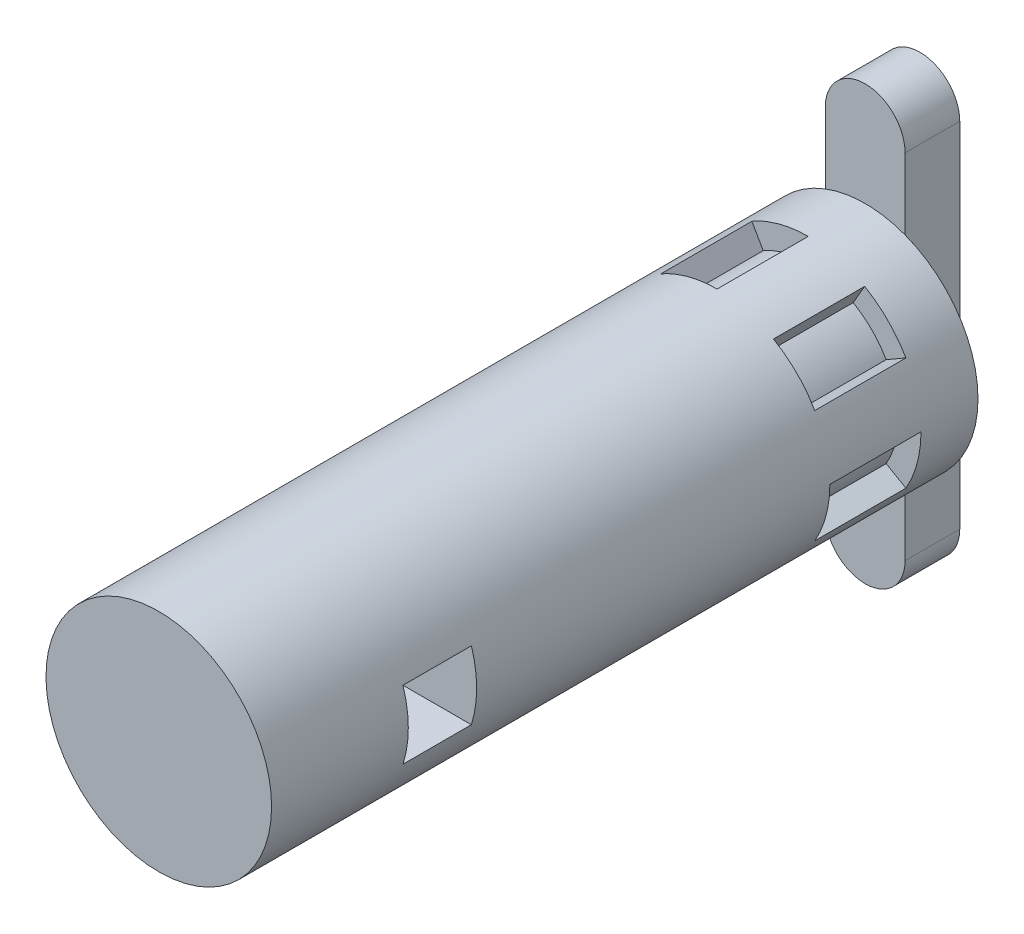
from build123d import *

# Parameters (mm, degrees)
SKETCH_1_R               = 4.95
EXTRUDE_1_DEPTH          = 4.5
CUT_EXTRUDE_1_DEPTH      = 2
PATTERN_CIRCULAR_1_COUNT = 6
MIRROR_1_COPY_1_DEPTH    = 2
MIRROR_1_COPY_2_DEPTH    = 2
MIRROR_1_COPY_3_DEPTH    = 2
MIRROR_1_COPY_4_DEPTH    = 2
MIRROR_1_COPY_5_DEPTH    = 2
EXTRUDE_2_DEPTH          = 2.4
SKETCH_5_R               = 4.95
EXTRUDE_3_DEPTH          = 22
CUT_EXTRUDE_2_DEPTH      = 29.583255588
CUT_EXTRUDE_2_DEPTH_BACK = 29.583255588
SKETCH_6_W               = 3
SKETCH_6_H               = 3


with BuildPart() as part:
    # 草图1 → 凸台-拉伸1 (new body)
    with BuildSketch(Plane.XY):
        Circle(SKETCH_1_R)
    extrude_1 = extrude(amount=EXTRUDE_1_DEPTH)

    # 草图2 → 切除-拉伸1 (cut)
    with BuildSketch(Plane(origin=(0, 0, 0), x_dir=(-1, 0, 0), z_dir=(0, 0, -1))):
        with BuildLine():
            Line((0, 4.95), (0, 3.95))
            ThreePointArc((0, 3.95), (1.022335228, 3.815407014), (1.975, 3.420800345))
            Line((1.975, 3.420800345), (2.475, 4.286825749))
            ThreePointArc((2.475, 4.286825749), (1.281154273, 4.78133284), (0, 4.95))
        make_face()
    cut_extrude_1 = extrude(amount=-CUT_EXTRUDE_1_DEPTH, mode=Mode.SUBTRACT)

    # 阵列(圆周)1: 切除-拉伸1 ×6 about axis
    pattern_circular_1_axis = Axis((0, 0, 0), (0, 0, 1))
    for i in range(1, PATTERN_CIRCULAR_1_COUNT):
        add(cut_extrude_1.rotate(pattern_circular_1_axis, i * 360 / PATTERN_CIRCULAR_1_COUNT), mode=Mode.SUBTRACT)

    # 镜向1: 凸台-拉伸1, 切除-拉伸1 across plane
    add(extrude_1.mirror(Plane.XY))
    add(cut_extrude_1.mirror(Plane.XY), mode=Mode.SUBTRACT)

    # 镜向1 copy 1 sketch → 镜向1 copy 1 (cut)
    with BuildSketch(Plane(origin=(0, 0, 0), x_dir=(-0.5000000000000001, -0.8660254037844386, 0), z_dir=(0, 0, 1))):
        with BuildLine():
            Line((0, -4.95), (0, -3.95))
            ThreePointArc((0, -3.95), (1.022335228, -3.815407014), (1.975, -3.420800345))
            Line((1.975, -3.420800345), (2.475, -4.286825749))
            ThreePointArc((2.475, -4.286825749), (1.281154273, -4.78133284), (0, -4.95))
        make_face()
    extrude(amount=-MIRROR_1_COPY_1_DEPTH, mode=Mode.SUBTRACT)

    # 镜向1 copy 2 sketch → 镜向1 copy 2 (cut)
    with BuildSketch(Plane(origin=(0, 0, 0), x_dir=(0.4999999999999998, -0.8660254037844387, 0), z_dir=(0, 0, 1))):
        with BuildLine():
            Line((0, -4.95), (0, -3.95))
            ThreePointArc((0, -3.95), (1.022335228, -3.815407014), (1.975, -3.420800345))
            Line((1.975, -3.420800345), (2.475, -4.286825749))
            ThreePointArc((2.475, -4.286825749), (1.281154273, -4.78133284), (0, -4.95))
        make_face()
    extrude(amount=-MIRROR_1_COPY_2_DEPTH, mode=Mode.SUBTRACT)

    # 镜向1 copy 3 sketch → 镜向1 copy 3 (cut)
    with BuildSketch(Plane.XY):
        with BuildLine():
            Line((0, -4.95), (0, -3.95))
            ThreePointArc((0, -3.95), (1.022335228, -3.815407014), (1.975, -3.420800345))
            Line((1.975, -3.420800345), (2.475, -4.286825749))
            ThreePointArc((2.475, -4.286825749), (1.281154273, -4.78133284), (0, -4.95))
        make_face()
    extrude(amount=-MIRROR_1_COPY_3_DEPTH, mode=Mode.SUBTRACT)

    # 镜向1 copy 4 sketch → 镜向1 copy 4 (cut)
    with BuildSketch(Plane(origin=(0, 0, 0), x_dir=(0.5000000000000004, 0.8660254037844384, 0), z_dir=(0, 0, 1))):
        with BuildLine():
            Line((0, -4.95), (0, -3.95))
            ThreePointArc((0, -3.95), (1.022335228, -3.815407014), (1.975, -3.420800345))
            Line((1.975, -3.420800345), (2.475, -4.286825749))
            ThreePointArc((2.475, -4.286825749), (1.281154273, -4.78133284), (0, -4.95))
        make_face()
    extrude(amount=-MIRROR_1_COPY_4_DEPTH, mode=Mode.SUBTRACT)

    # 镜向1 copy 5 sketch → 镜向1 copy 5 (cut)
    with BuildSketch(Plane(origin=(0, 0, 0), x_dir=(-0.5000000000000001, 0.8660254037844386, 0), z_dir=(0, 0, 1))):
        with BuildLine():
            Line((0, -4.95), (0, -3.95))
            ThreePointArc((0, -3.95), (1.022335228, -3.815407014), (1.975, -3.420800345))
            Line((1.975, -3.420800345), (2.475, -4.286825749))
            ThreePointArc((2.475, -4.286825749), (1.281154273, -4.78133284), (0, -4.95))
        make_face()
    extrude(amount=-MIRROR_1_COPY_5_DEPTH, mode=Mode.SUBTRACT)

    # 草图3 → 凸台-拉伸2 (add)
    with BuildSketch(Plane(origin=(0, 0, -4.5), x_dir=(-1, 0, 0), z_dir=(0, 0, -1))):
        with BuildLine():
            Line((1.75, 7.75), (1.75, -7.75))
            ThreePointArc((1.75, -7.75), (0, -9.5), (-1.75, -7.75))
            Line((-1.75, -7.75), (-1.75, 7.75))
            ThreePointArc((-1.75, 7.75), (0, 9.5), (1.75, 7.75))
        make_face()
    extrude(amount=EXTRUDE_2_DEPTH)

    # 草图5 → 凸台-拉伸3 (add)
    with BuildSketch(Plane.XY.offset(4.5)):
        with Locations(Location((0, 0, 0), (0, 0, 110.703706257))):
            Circle(SKETCH_5_R)
    extrude(amount=EXTRUDE_3_DEPTH)

    # 草图6 → 切除-拉伸2 (cut, two sides: drawn at the far end of the back side and taken through both)
    with BuildSketch(Plane(origin=(0, 0, 0), x_dir=(0, 0, -1), z_dir=(1, 0, 0)).offset(-CUT_EXTRUDE_2_DEPTH_BACK)):
        with Locations((-19, 0)):
            Rectangle(SKETCH_6_W, SKETCH_6_H)
    extrude(amount=CUT_EXTRUDE_2_DEPTH + CUT_EXTRUDE_2_DEPTH_BACK, mode=Mode.SUBTRACT)


solid = part.part
